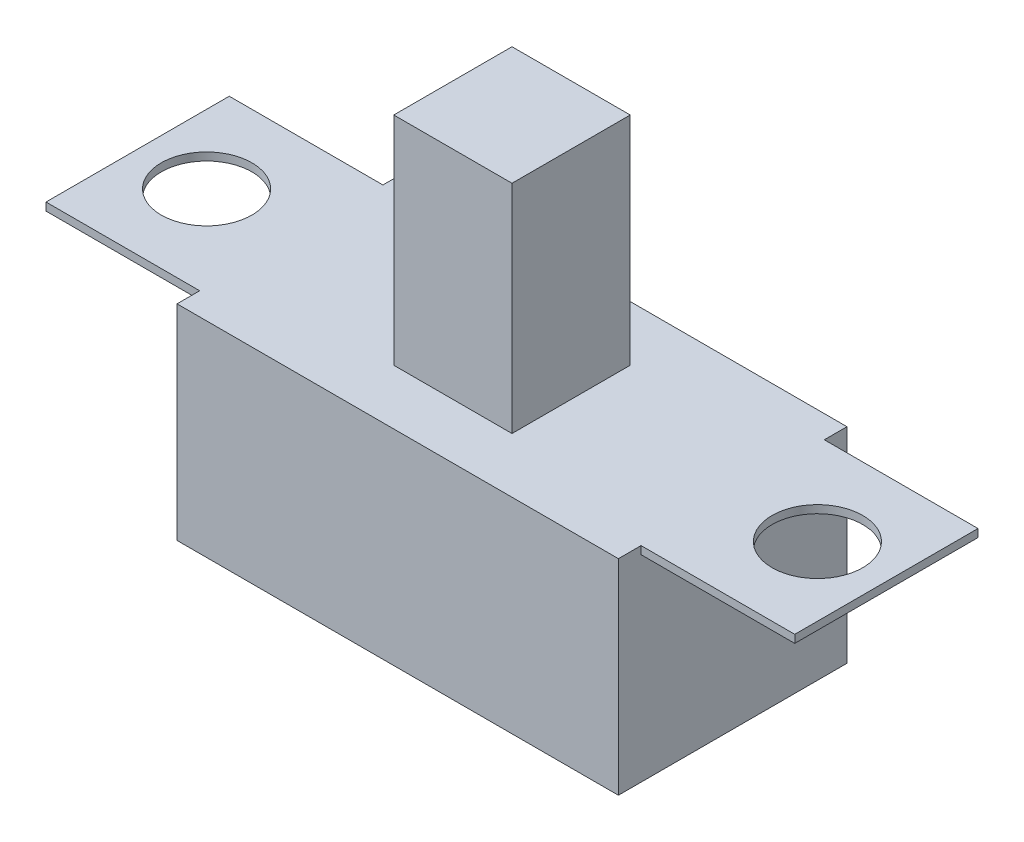
from build123d import *

# Parameters (mm, degrees)
SKETCH1_R           = 1.15
BOSS_EXTRUDE1_DEPTH = 0.2
SKETCH2_W           = 11.2
SKETCH2_H           = 5.8
BOSS_EXTRUDE2_DEPTH = 5
SKETCH3_W           = 3
SKETCH3_H           = 3
BOSS_EXTRUDE3_DEPTH = 5.5


with BuildPart() as part:
    # Sketch1 → Boss-Extrude1 (new body)
    with BuildSketch(Plane(origin=(0, 0, 0), x_dir=(1, 0, 0), z_dir=(0, 1, 0))):
        Polygon((9.5, 2.325), (9.5, -2.325), (5.6, -2.325), (5.6, -2.9), (-5.6, -2.9), (-5.6, -2.325), (-9.5, -2.325), (-9.5, 2.325), (-5.6, 2.325), (-5.6, 2.9), (5.6, 2.9), (5.6, 2.325), align=None)
        with Locations(Location((-7.75, 0, 0), (0, 0, 270))):
            Circle(SKETCH1_R, mode=Mode.SUBTRACT)
        with Locations(Location((7.75, 0, 0), (0, 0, 270))):
            Circle(SKETCH1_R, mode=Mode.SUBTRACT)
    extrude(amount=BOSS_EXTRUDE1_DEPTH)

    # Sketch2 → Boss-Extrude2 (add)
    with BuildSketch(Plane.XZ):
        Rectangle(SKETCH2_W, SKETCH2_H)
    extrude(amount=BOSS_EXTRUDE2_DEPTH)

    # Sketch3 → Boss-Extrude3 (add)
    with BuildSketch(Plane(origin=(0, 0.2, 0), x_dir=(1, 0, 0), z_dir=(0, 1, 0))):
        Rectangle(SKETCH3_W, SKETCH3_H)
    extrude(amount=BOSS_EXTRUDE3_DEPTH)


solid = part.part
